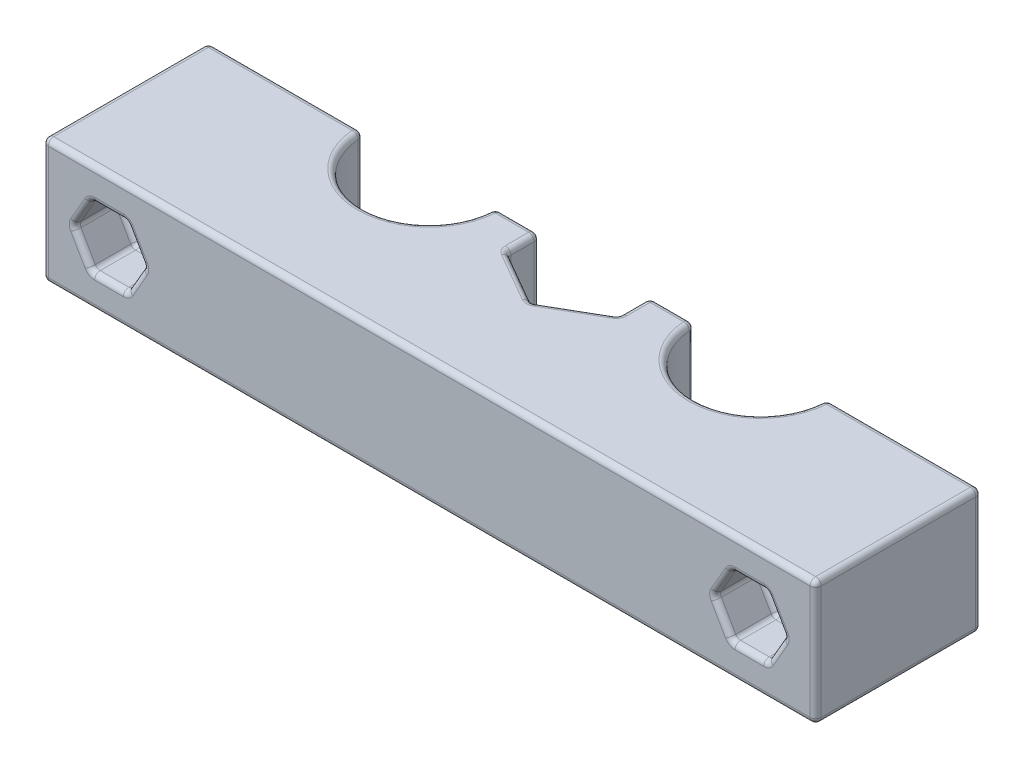
from build123d import *

# Parameters (mm, degrees)
BOSS_EXTRUDE1_DEPTH = 11.3
SKETCH2_R           = 1.6
CUT_EXTRUDE1_DEPTH  = 73.475444117
CUT_EXTRUDE3_DEPTH  = 4.2
FILLET5_R           = 0.5


with BuildPart() as part:
    # Sketch1 → Boss-Extrude1 (new body)
    with BuildSketch(Plane(origin=(0, 0, 0), x_dir=(1, 0, 0), z_dir=(0, 1, 0))):
        with BuildLine():
            Line((56, 15), (70, 15))
            Line((70, 15), (70, 0))
            Line((70, 0), (0, 0))
            Line((0, 0), (0, 15))
            Line((0, 15), (14, 15))
            ThreePointArc((14, 15), (20, 9), (26, 15))
            Line((26, 15), (30, 15))
            Line((30, 15), (30, 12.113248654))
            Line((30, 12.113248654), (35, 9.226497308))
            Line((35, 9.226497308), (40, 12.113248654))
            Line((40, 12.113248654), (40, 15))
            Line((40, 15), (44, 15))
            ThreePointArc((44, 15), (50, 9), (56, 15))
        make_face()
    extrude(amount=BOSS_EXTRUDE1_DEPTH)

    # Sketch2 → Cut-Extrude1 (cut, through all)
    with BuildSketch(Plane.XY):
        with Locations((6, 5.65)):
            Circle(SKETCH2_R)
        with Locations((64, 5.65)):
            Circle(SKETCH2_R)
    extrude(amount=-CUT_EXTRUDE1_DEPTH, mode=Mode.SUBTRACT)

    # Sketch4 → Cut-Extrude3 (cut)
    with BuildSketch(Plane.XY):
        Polygon((9.175426481, 5.65), (7.58771324, 8.4), (4.41228676, 8.4), (2.824573519, 5.65), (4.41228676, 2.9), (7.58771324, 2.9), align=None)
        Polygon((62.41228676, 2.9), (60.824573519, 5.65), (62.41228676, 8.4), (65.58771324, 8.4), (67.175426481, 5.65), (65.58771324, 2.9), align=None)
    extrude(amount=-CUT_EXTRUDE3_DEPTH, mode=Mode.SUBTRACT)

    # Fillet5
    fillet5_edges = [part.edges().sort_by_distance(p)[0] for p in [
        (70, 11.3, -7.5),
        (7, 0, -15),
        (20, 0, -9),
        (28, 0, -15),
        (30, 0, -13.556624327),
        (32.5, 0, -10.669872981),
        (37.5, 0, -10.669872981),
        (40, 0, -13.556624327),
        (42, 0, -15),
        (50, 0, -9),
        (63, 0, -15),
        (63, 11.3, -15),
        (70, 0, -7.5),
        (35, 0, 0),
        (0, 0, -7.5),
        (50, 11.3, -9),
        (0, 5.65, -15),
        (14, 5.65, -15),
        (26, 5.65, -15),
        (30, 5.65, -15),
        (30, 5.65, -12.113248654),
        (35, 5.65, -9.226497308),
        (40, 5.65, -12.113248654),
        (40, 5.65, -15),
        (44, 5.65, -15),
        (56, 5.65, -15),
        (70, 5.65, -15),
        (70, 5.65, 0),
        (0, 5.65, 0),
        (42, 11.3, -15),
        (40, 11.3, -13.556624327),
        (37.5, 11.3, -10.669872981),
        (32.5, 11.3, -10.669872981),
        (4.4, 5.65, -15),
        (30, 11.3, -13.556624327),
        (62.4, 5.65, -15),
        (28, 11.3, -15),
        (20, 11.3, -9),
        (0, 11.3, -7.5),
        (7, 11.3, -15),
        (8.38156986, 4.275, 0),
        (8.38156986, 7.025, 0),
        (6, 8.4, 0),
        (3.61843014, 7.025, 0),
        (3.61843014, 4.275, 0),
        (6, 2.9, 0),
        (8.38156986, 4.275, -4.2),
        (9.175426481, 5.65, -2.1),
        (6, 2.9, -4.2),
        (7.58771324, 2.9, -2.1),
        (3.61843014, 4.275, -4.2),
        (4.41228676, 2.9, -2.1),
        (3.61843014, 7.025, -4.2),
        (2.824573519, 5.65, -2.1),
        (6, 8.4, -4.2),
        (4.41228676, 8.4, -2.1),
        (8.38156986, 7.025, -4.2),
        (7.58771324, 8.4, -2.1),
        (4.4, 5.65, -4.2),
        (62.4, 5.65, -4.2),
        (64, 2.9, 0),
        (66.38156986, 4.275, 0),
        (66.38156986, 7.025, 0),
        (64, 8.4, 0),
        (61.61843014, 7.025, 0),
        (61.61843014, 4.275, 0),
        (64, 2.9, -4.2),
        (65.58771324, 2.9, -2.1),
        (61.61843014, 4.275, -4.2),
        (62.41228676, 2.9, -2.1),
        (61.61843014, 7.025, -4.2),
        (60.824573519, 5.65, -2.1),
        (64, 8.4, -4.2),
        (62.41228676, 8.4, -2.1),
        (66.38156986, 7.025, -4.2),
        (65.58771324, 8.4, -2.1),
        (66.38156986, 4.275, -4.2),
        (67.175426481, 5.65, -2.1),
        (35, 11.3, 0),
    ]]
    fillet(fillet5_edges, radius=FILLET5_R)


solid = part.part
